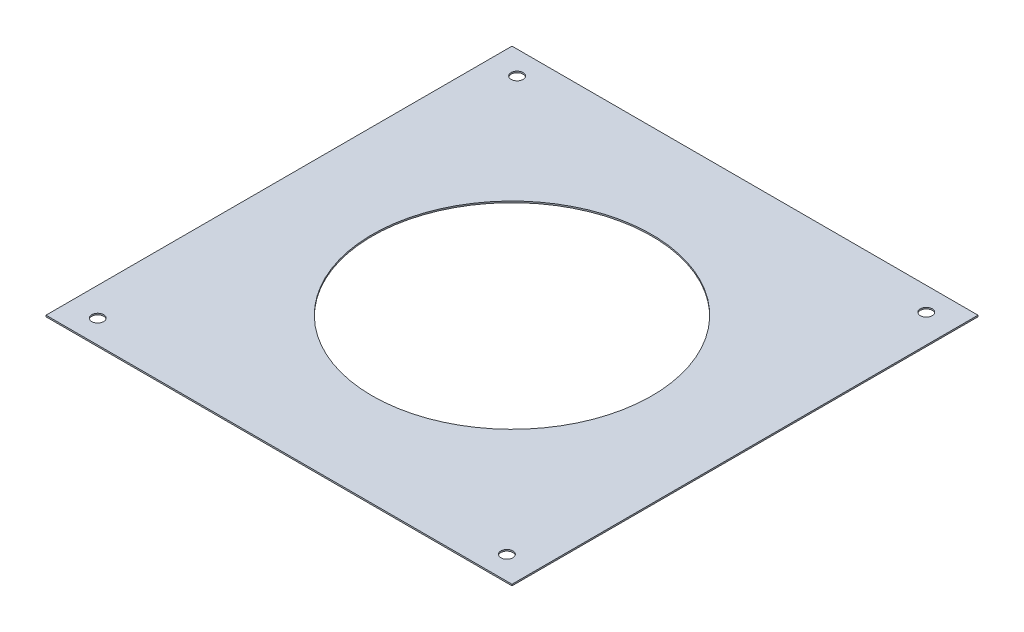
from build123d import *

# Parameters (mm, degrees)
SKETCH1_W           = 254
SKETCH1_H           = 254
SKETCH1_R           = 3.2639
SKETCH1_R_2         = 76.2
BOSS_EXTRUDE1_DEPTH = 0.79375


with BuildPart() as part:
    # Sketch1 → Boss-Extrude1 (new body)
    with BuildSketch(Plane(origin=(0, 0, 0), x_dir=(1, 0, 0), z_dir=(0, 1, 0))):
        with Locations((127, 127)):
            Rectangle(SKETCH1_W, SKETCH1_H)
        with Locations(Location((15.494, 241.3, 0), (0, 0, 270))):
            Circle(SKETCH1_R, mode=Mode.SUBTRACT)
        with Locations(Location((238.506, 241.3, 0), (0, 0, 270))):
            Circle(SKETCH1_R, mode=Mode.SUBTRACT)
        with Locations(Location((238.506, 12.7, 0), (0, 0, 270))):
            Circle(SKETCH1_R, mode=Mode.SUBTRACT)
        with Locations(Location((15.494, 12.7, 0), (0, 0, 270))):
            Circle(SKETCH1_R, mode=Mode.SUBTRACT)
        with Locations(Location((127, 127, 0), (0, 0, 270))):
            Circle(SKETCH1_R_2, mode=Mode.SUBTRACT)
    extrude(amount=BOSS_EXTRUDE1_DEPTH)


solid = part.part
